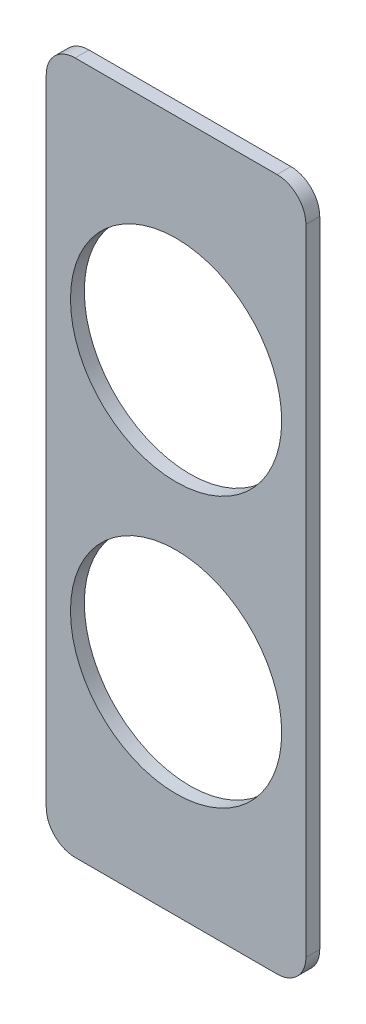
from build123d import *

# Parameters (mm, degrees)
SKETCH1_R           = 23.241
BOSS_EXTRUDE1_DEPTH = 3.048


with BuildPart() as part:
    # Sketch1 → Boss-Extrude1 (new body)
    with BuildSketch(Plane.XY):
        with BuildLine():
            Line((-22.225, 76.2), (22.225, 76.2))
            ThreePointArc((22.225, 76.2), (26.715128061, 74.340128061), (28.575, 69.85))
            Line((28.575, 69.85), (28.575, -69.85))
            ThreePointArc((28.575, -69.85), (26.715128061, -74.340128061), (22.225, -76.2))
            Line((22.225, -76.2), (-22.225, -76.2))
            ThreePointArc((-22.225, -76.2), (-26.715128061, -74.340128061), (-28.575, -69.85))
            Line((-28.575, -69.85), (-28.575, 69.85))
            ThreePointArc((-28.575, 69.85), (-26.715128061, 74.340128061), (-22.225, 76.2))
        make_face()
        with Locations((0, 29.718)):
            Circle(SKETCH1_R, mode=Mode.SUBTRACT)
        with Locations((0, -29.718)):
            Circle(SKETCH1_R, mode=Mode.SUBTRACT)
    extrude(amount=-BOSS_EXTRUDE1_DEPTH)


solid = part.part
